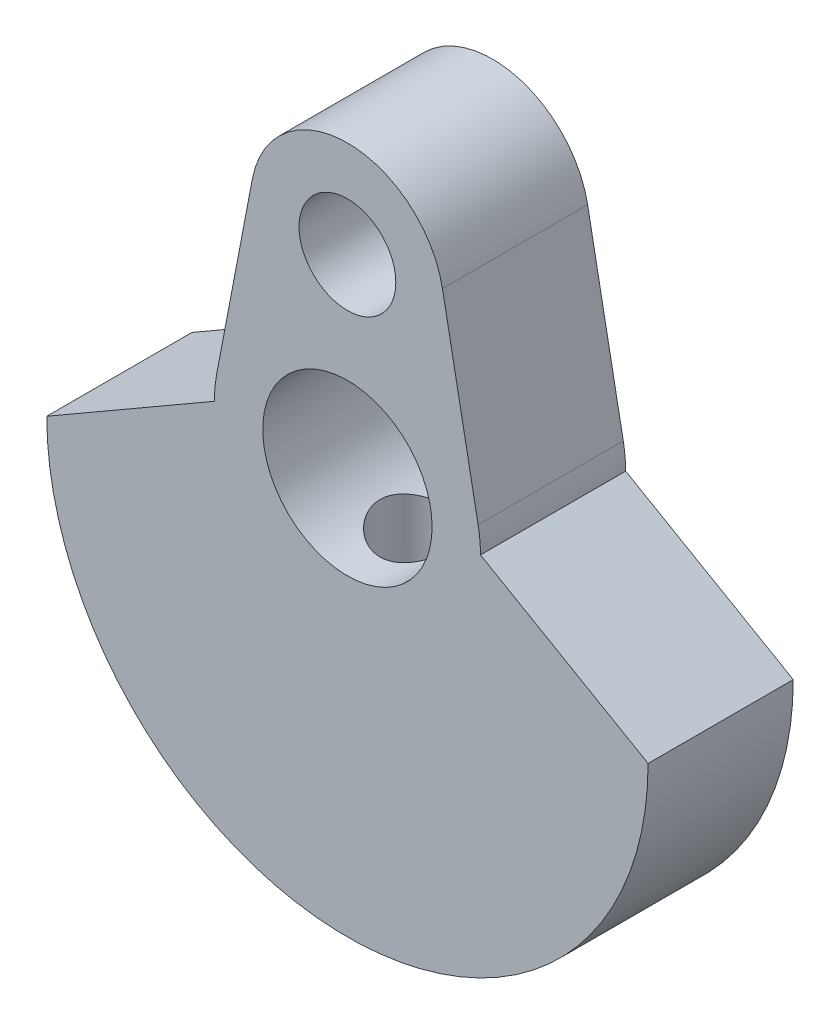
from build123d import *
from build123d.topology import SkipClean

# Parameters (mm, degrees)
BOSS_EXTRUDE1_DEPTH    = 3
SKETCH1_R              = 2
BOSS_EXTRUDE1_2_DEPTH  = 3
BOSS_EXTRUDE2_DEPTH    = 3
M4_TAPPED_HOLE1_REACH  = 33.171
M4_TAPPED_HOLE1_BORE_R = 1.65


with BuildPart() as part:
    # Sketch1 → Boss-Extrude1 (new, symmetric)
    with BuildSketch(Plane.XY):
        with BuildLine():
            ThreePointArc((5.5, 0), (0, -5.5), (-5.5, 0))
            Line((-5.5, 0), (-12.42820323, -4))
            ThreePointArc((-12.42820323, -4), (0, -16.42820323), (12.42820323, -4))
            Line((12.42820323, -4), (5.5, 0))
        make_face()
    extrude(amount=BOSS_EXTRUDE1_DEPTH, both=True)



with BuildPart() as body_2:
    # Sketch1 → Boss-Extrude1 2 (new, symmetric)
    with BuildSketch(Plane.XY):
        with BuildLine():
            Line((-3.929058411, 8.75), (-5.402455316, 1.03125))
            ThreePointArc((-5.402455316, 1.03125), (0, 5.5), (5.402455316, 1.03125))
            Line((5.402455316, 1.03125), (3.929058411, 8.75))
            ThreePointArc((3.929058411, 8.75), (0, 12), (-3.929058411, 8.75))
        make_face()
        with Locations((0, 8)):
            Circle(SKETCH1_R, mode=Mode.SUBTRACT)
    extrude(amount=BOSS_EXTRUDE1_2_DEPTH, both=True)


with BuildPart() as part_1:
    with SkipClean():  # the faces are left unmerged after this step: merging them gives an invalid solid
        add(part.part)

        add(body_2.part)  # Boss-Extrude2 merges body 2
        # Sketch1<3> → Boss-Extrude2 (add, symmetric)
        with BuildSketch(Plane.XY):
            with BuildLine():
                ThreePointArc((-3.5, 0), (0, 3.5), (3.5, 0))
                Line((3.5, 0), (5.5, 0))
                ThreePointArc((5.5, 0), (5.475559526, 0.517926522), (5.402455316, 1.03125))
                ThreePointArc((5.402455316, 1.03125), (0, 5.5), (-5.402455316, 1.03125))
                ThreePointArc((-5.402455316, 1.03125), (-5.475559526, 0.517926522), (-5.5, 0))
                Line((-5.5, 0), (-3.5, 0))
            make_face()
            with BuildLine():
                Line((5.5, 0), (3.5, 0))
                ThreePointArc((3.5, 0), (0, -3.5), (-3.5, 0))
                Line((-3.5, 0), (-5.5, 0))
                ThreePointArc((-5.5, 0), (0, -5.5), (5.5, 0))
            make_face()
        extrude(amount=BOSS_EXTRUDE2_DEPTH, both=True)

    # M4 Tapped Hole1 bore → M4 Tapped Hole1 (cut, up to next)
    with BuildSketch(Plane(origin=(0, -16.42820323, 0), x_dir=(-1, 0, 0), z_dir=(0, -1, 0)), mode=Mode.PRIVATE) as m4_tapped_hole1_sk1:
        Circle(M4_TAPPED_HOLE1_BORE_R)
    m4_tapped_hole1_tool1 = extrude(m4_tapped_hole1_sk1.sketch, amount=-M4_TAPPED_HOLE1_REACH, mode=Mode.PRIVATE) & part_1.part
    add(m4_tapped_hole1_tool1.solids().sort_by_distance((0, -16.428203, 0))[0], mode=Mode.SUBTRACT)


solid = part_1.part
